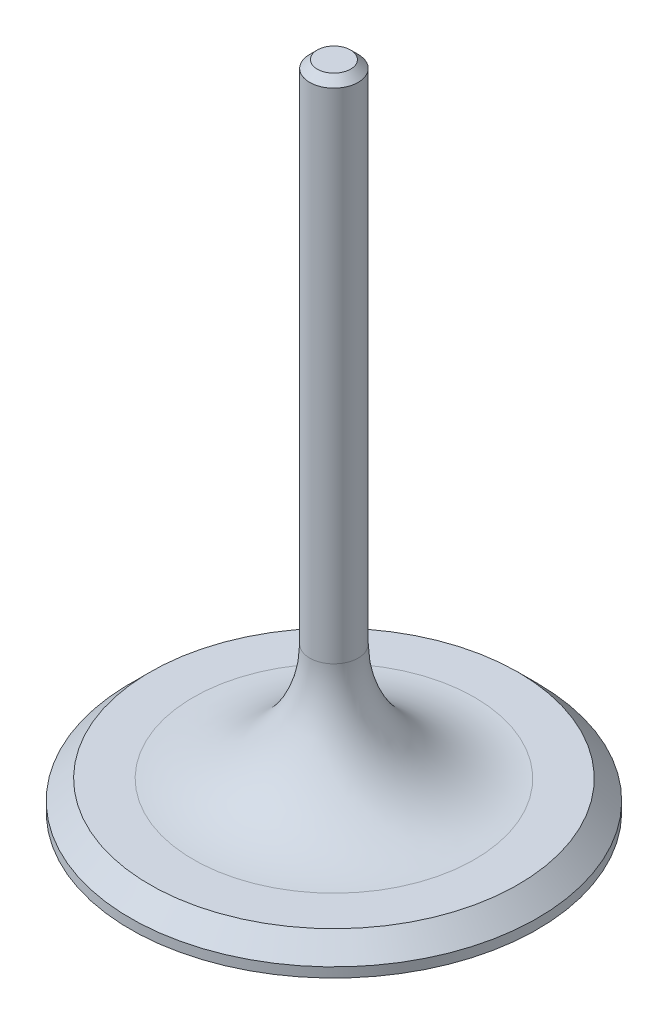
from build123d import *

# Parameters (mm, degrees)
FILLET1_R     = 15.25
CHAMFER1_SIZE = 1


with BuildPart() as part:
    # Sketch1 → Revolve1 (revolve)
    with BuildSketch(Plane.XY, mode=Mode.PRIVATE) as revolve1_sk:
        Polygon((0, 0), (-26.67, 0), (-26.67, 1.27), (-24.131486656, 3.808513344), (-3.18, 3.808513344), (-3.18, 85.408513344), (0, 85.408513344), align=None)
    revolve(revolve1_sk.sketch.rotate(Axis((0, 0, 0), (0, 1, 0)), 270), axis=Axis((0, 0, 0), (0, 1, 0)))

    # Fillet1
    fillet1_edges = [part.edges().sort_by_distance(p)[0] for p in [
        (0, 3.808513344, 3.18),
    ]]
    fillet(fillet1_edges, radius=FILLET1_R)

    # Chamfer1
    chamfer1_edges = [part.edges().sort_by_distance(p)[0] for p in [
        (0, 85.408513344, 3.18),
    ]]
    chamfer(chamfer1_edges, length=CHAMFER1_SIZE)


solid = part.part
